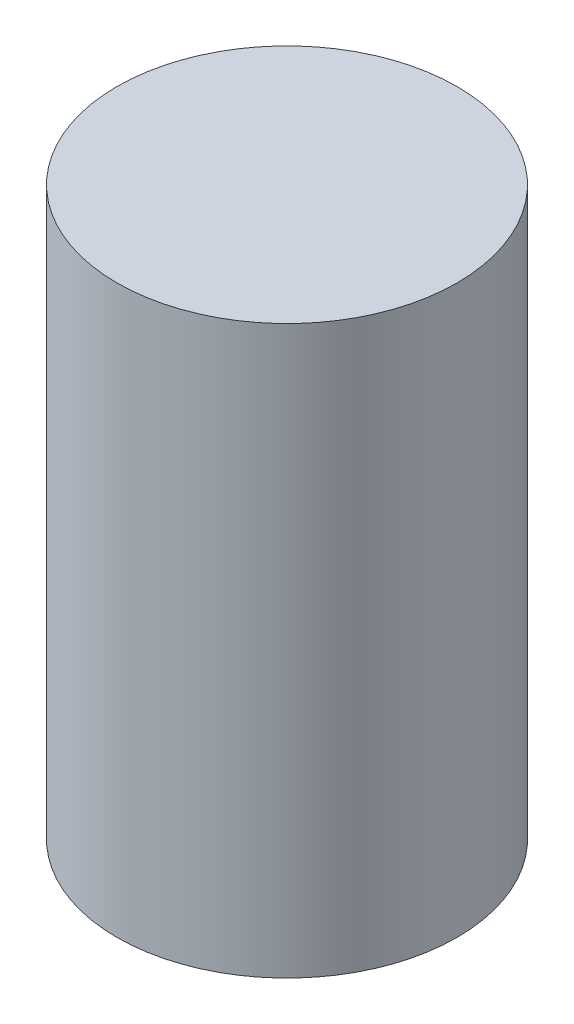
from build123d import *

# Parameters (mm, degrees)
SKETCH1_R           = 1.5
BOSS_EXTRUDE1_DEPTH = 5


with BuildPart() as part:
    # Sketch1 → Boss-Extrude1 (new body)
    with BuildSketch(Plane(origin=(0, 0, 0), x_dir=(1, 0, 0), z_dir=(0, 1, 0))):
        with Locations(Location((0, 0, 0), (0, 0, 270))):
            Circle(SKETCH1_R)
    extrude(amount=-BOSS_EXTRUDE1_DEPTH)


solid = part.part
